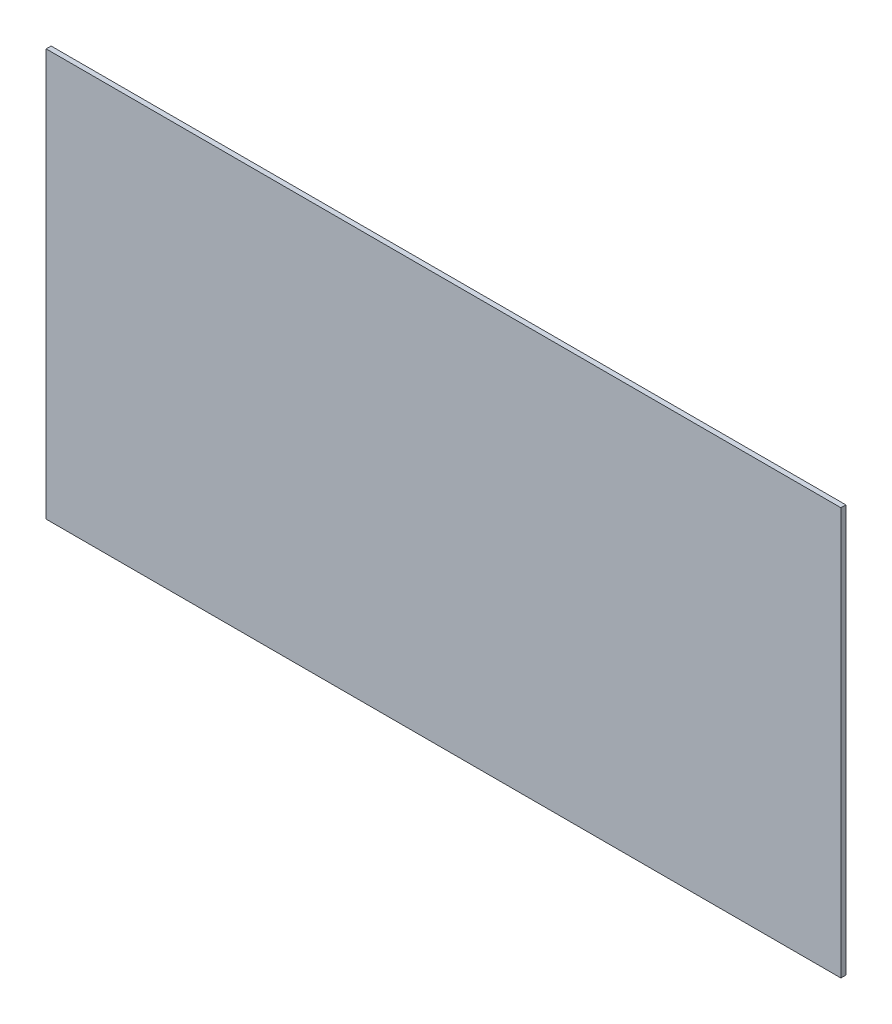
from build123d import *

# Parameters (mm, degrees)
SKETCH1_W           = 508
SKETCH1_H           = 260.35
BOSS_EXTRUDE1_DEPTH = 3.175


with BuildPart() as part:
    # Sketch1 → Boss-Extrude1 (new body)
    with BuildSketch(Plane.XY):
        Rectangle(SKETCH1_W, SKETCH1_H)
    extrude(amount=BOSS_EXTRUDE1_DEPTH)


solid = part.part
